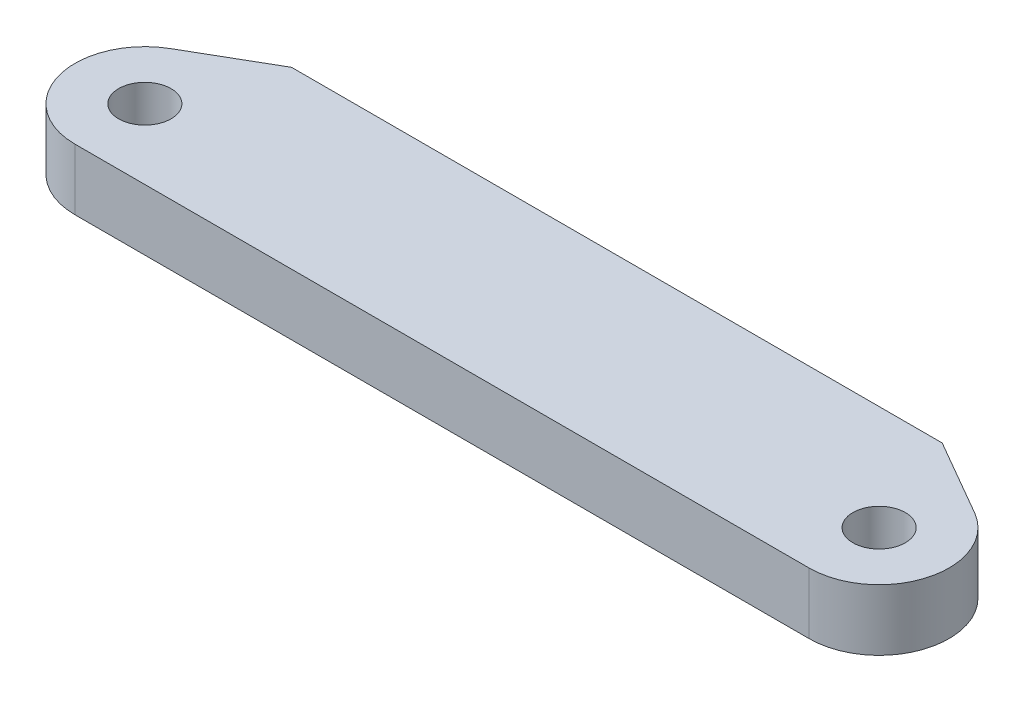
from build123d import *

# Parameters (mm, degrees)
BOSS_EXTRUDE1_DEPTH = 3.5
SKETCH2_R           = 1.5
CUT_EXTRUDE1_DEPTH  = 26.734218465


with BuildPart() as part:
    # Sketch1 → Boss-Extrude1 (new body)
    with BuildSketch(Plane(origin=(0, 0, 0), x_dir=(1, 0, 0), z_dir=(0, 1, 0))):
        with BuildLine():
            Line((-18.607695155, -5), (18.607695155, -5))
            Line((18.607695155, -5), (21, -5))
            ThreePointArc((21, -5), (24.863703305, -2.03527618), (23, 2.464101615))
            Line((23, 2.464101615), (18.607695155, 5))
            Line((18.607695155, 5), (-18.607695155, 5))
            Line((-18.607695155, 5), (-23, 2.464101615))
            ThreePointArc((-23, 2.464101615), (-24.863703305, -2.03527618), (-21, -5))
            Line((-21, -5), (-18.607695155, -5))
        make_face()
    extrude(amount=BOSS_EXTRUDE1_DEPTH)

    # Sketch2 → Cut-Extrude1 (cut, through all)
    with BuildSketch(Plane(origin=(0, 3.5, 0), x_dir=(1, 0, 0), z_dir=(0, 1, 0))):
        with Locations(Location((-21, -1, 0), (0, 0, 270))):
            Circle(SKETCH2_R)
        with Locations(Location((21, -1, 0), (0, 0, 270))):
            Circle(SKETCH2_R)
    extrude(amount=-CUT_EXTRUDE1_DEPTH, mode=Mode.SUBTRACT)


solid = part.part
